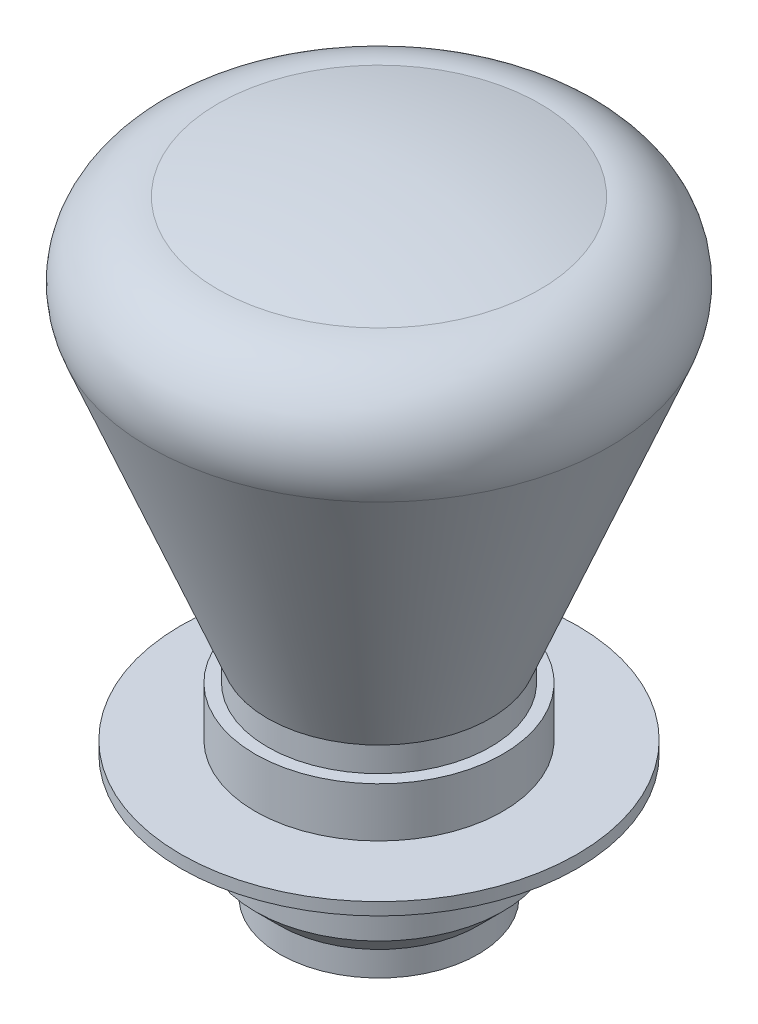
from build123d import *


with BuildPart() as part:
    # Sketch1 → Revolve1 (revolve)
    with BuildSketch(Plane.XY, mode=Mode.PRIVATE) as revolve1_sk:
        with BuildLine():
            Line((0, -33.262039486), (0, -8.762039486))
            Line((0, -8.762039486), (-6.5, -8.762039486))
            ThreePointArc((-6.5, -8.762039486), (-8.986095711, -10.082953987), (-9.282911506, -12.88248741))
            Line((-9.282911506, -12.88248741), (-4.5, -24.762039486))
            Line((-4.5, -24.762039486), (-4.5, -25.762039486))
            Line((-4.5, -25.762039486), (-5, -25.762039486))
            Line((-5, -25.762039486), (-5, -27.762039486))
            Line((-5, -27.762039486), (-8, -27.762039486))
            Line((-8, -27.762039486), (-8, -28.262039486))
            Line((-8, -28.262039486), (-5, -28.262039486))
            Line((-5, -28.262039486), (-5, -31.262039486))
            Line((-5, -31.262039486), (-4, -32.262039486))
            Line((-4, -32.262039486), (-4, -33.262039486))
            Line((-4, -33.262039486), (0, -33.262039486))
        make_face()
        with BuildLine():
            Line((0, -8.762039486), (0, -7.998248901))
            ThreePointArc((0, -7.998248901), (-3.272360618, -8.189851173), (-6.5, -8.762039486))
            Line((-6.5, -8.762039486), (0, -8.762039486))
        make_face()
    revolve(revolve1_sk.sketch.rotate(Axis((0, 89.34036061, 0), (0, -1, 0)), 270), axis=Axis((0, 89.34036061, 0), (0, -1, 0)))


solid = part.part
